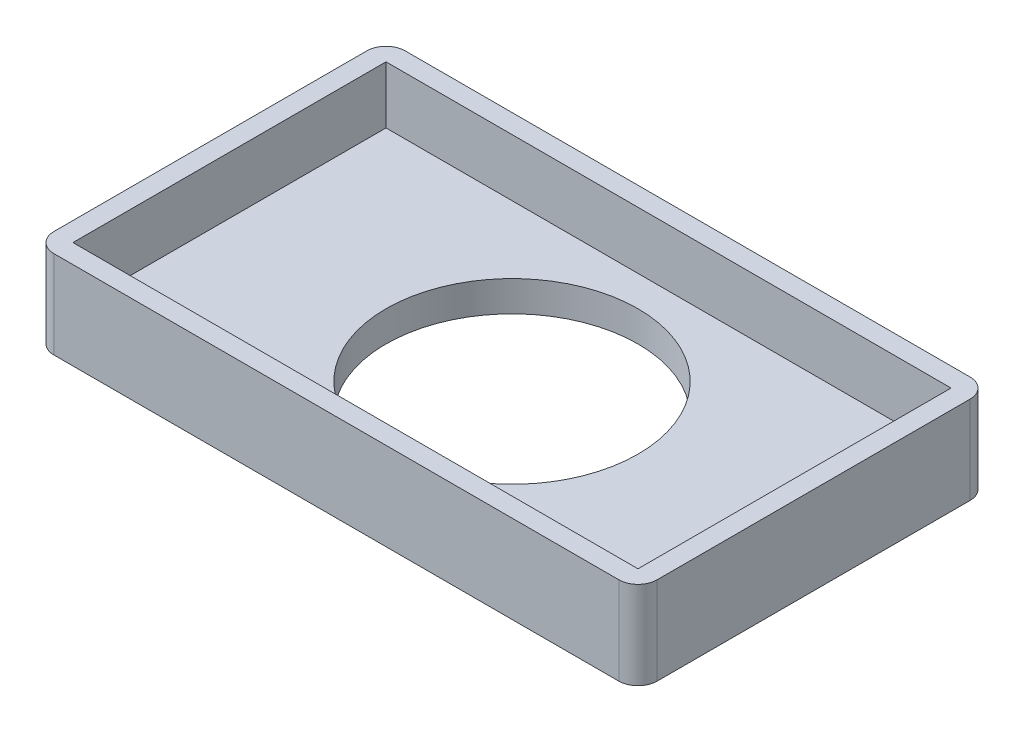
from build123d import *

# Parameters (mm, degrees)
SKETCH1_W           = 158
SKETCH1_H           = 92
BOSS_EXTRUDE1_DEPTH = 8
SKETCH2_W           = 158
SKETCH2_H           = 92
SKETCH2_W_2         = 148
SKETCH2_H_2         = 82
BOSS_EXTRUDE2_DEPTH = 15
SKETCH3_R           = 33
CUT_EXTRUDE1_DEPTH  = 95.265582266
FILLET1_R           = 5
FILLET2_R           = 5


with BuildPart() as part:
    # Sketch1 → Boss-Extrude1 (new body)
    with BuildSketch(Plane(origin=(0, 0, 0), x_dir=(1, 0, 0), z_dir=(0, 1, 0))):
        Rectangle(SKETCH1_W, SKETCH1_H)
    extrude(amount=BOSS_EXTRUDE1_DEPTH)

    # Sketch2 → Boss-Extrude2 (add)
    with BuildSketch(Plane(origin=(0, 8, 0), x_dir=(1, 0, 0), z_dir=(0, 1, 0))):
        Rectangle(SKETCH2_W, SKETCH2_H)
        Rectangle(SKETCH2_W_2, SKETCH2_H_2, mode=Mode.SUBTRACT)
    extrude(amount=BOSS_EXTRUDE2_DEPTH)

    # Sketch3 → Cut-Extrude1 (cut, through all)
    with BuildSketch(Plane.XZ):
        with Locations(Location((0, 0, 0), (0, 0, 270))):
            Circle(SKETCH3_R)
    extrude(amount=-CUT_EXTRUDE1_DEPTH, mode=Mode.SUBTRACT)

    # Fillet1
    fillet1_edges = [part.edges().sort_by_distance(p)[0] for p in [
        (-79, 11.5, 46),
    ]]
    fillet(fillet1_edges, radius=FILLET1_R)

    # Fillet2
    fillet2_edges = [part.edges().sort_by_distance(p)[0] for p in [
        (79, 11.5, 46),
        (-79, 11.5, -46),
        (79, 11.5, -46),
    ]]
    fillet(fillet2_edges, radius=FILLET2_R)


solid = part.part
